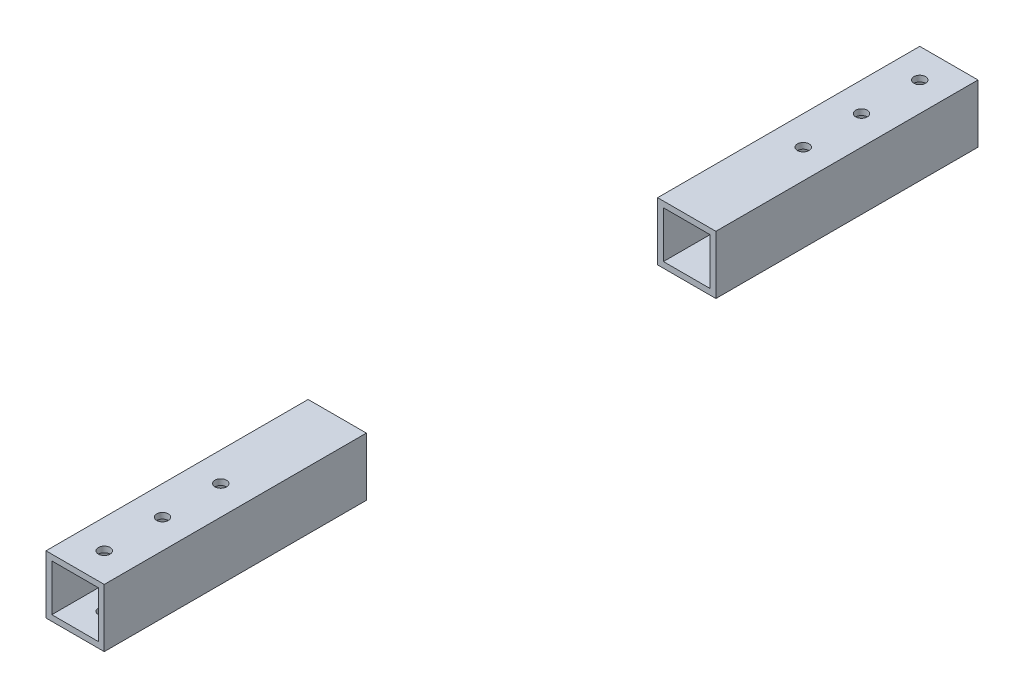
from build123d import *

# Parameters (mm, degrees)
SKETCH_1_W          = 20
SKETCH_1_H          = 20
SKETCH_1_W_2        = 16
SKETCH_1_H_2        = 16
EXTRUDE_1_DEPTH     = 300
SKETCH_2_R          = 2
CUT_EXTRUDE_1_DEPTH = 302.330383466
SKETCH_3_W          = 20
SKETCH_3_H          = 120
CUT_EXTRUDE_2_DEPTH = 302.330383466


with BuildPart() as part:
    # 草图1 → 拉伸-薄壁1 (new body)
    with BuildSketch(Plane.XY):
        with Locations((10, 10)):
            Rectangle(SKETCH_1_W, SKETCH_1_H)
        with Locations((10, 10)):
            Rectangle(SKETCH_1_W_2, SKETCH_1_H_2, mode=Mode.SUBTRACT)
    extrude(amount=EXTRUDE_1_DEPTH)

    # 草图2 → 切除-拉伸1 (cut, through all)
    with BuildSketch(Plane(origin=(0, 20, 0), x_dir=(1, 0, 0), z_dir=(0, 1, 0))):
        with Locations(Location((10, -290, 0), (0, 0, 270))):
            Circle(SKETCH_2_R)
        with Locations(Location((10, -270, 0), (0, 0, 270))):
            Circle(SKETCH_2_R)
        with Locations(Location((10, -250, 0), (0, 0, 270))):
            Circle(SKETCH_2_R)
        with Locations(Location((10, -10, 0), (0, 0, 90))):
            Circle(SKETCH_2_R)
        with Locations(Location((10, -30, 0), (0, 0, 90))):
            Circle(SKETCH_2_R)
        with Locations(Location((10, -50, 0), (0, 0, 90))):
            Circle(SKETCH_2_R)
    extrude(amount=-CUT_EXTRUDE_1_DEPTH, mode=Mode.SUBTRACT)

    # 草图3 → 切除-拉伸2 (cut, through all)
    with BuildSketch(Plane(origin=(0, 20, 0), x_dir=(1, 0, 0), z_dir=(0, 1, 0))):
        with Locations((10, -150)):
            Rectangle(SKETCH_3_W, SKETCH_3_H)
    extrude(amount=-CUT_EXTRUDE_2_DEPTH, mode=Mode.SUBTRACT)


with BuildPart() as cut_extrude_2_piece_1:
    # of the separate pieces the step leaves, piece 1, a body of its own (cut_extrude_2_pieces)
    add(part.part.solids().sort_by_distance((20, 20, 0))[0])


with BuildPart() as cut_extrude_2_piece_2:
    # of the separate pieces the step leaves, piece 2, a body of its own (cut_extrude_2_pieces)
    add(part.part.solids().sort_by_distance((20, 20, 210))[0])


solid = Compound([cut_extrude_2_piece_1.part, cut_extrude_2_piece_2.part])
